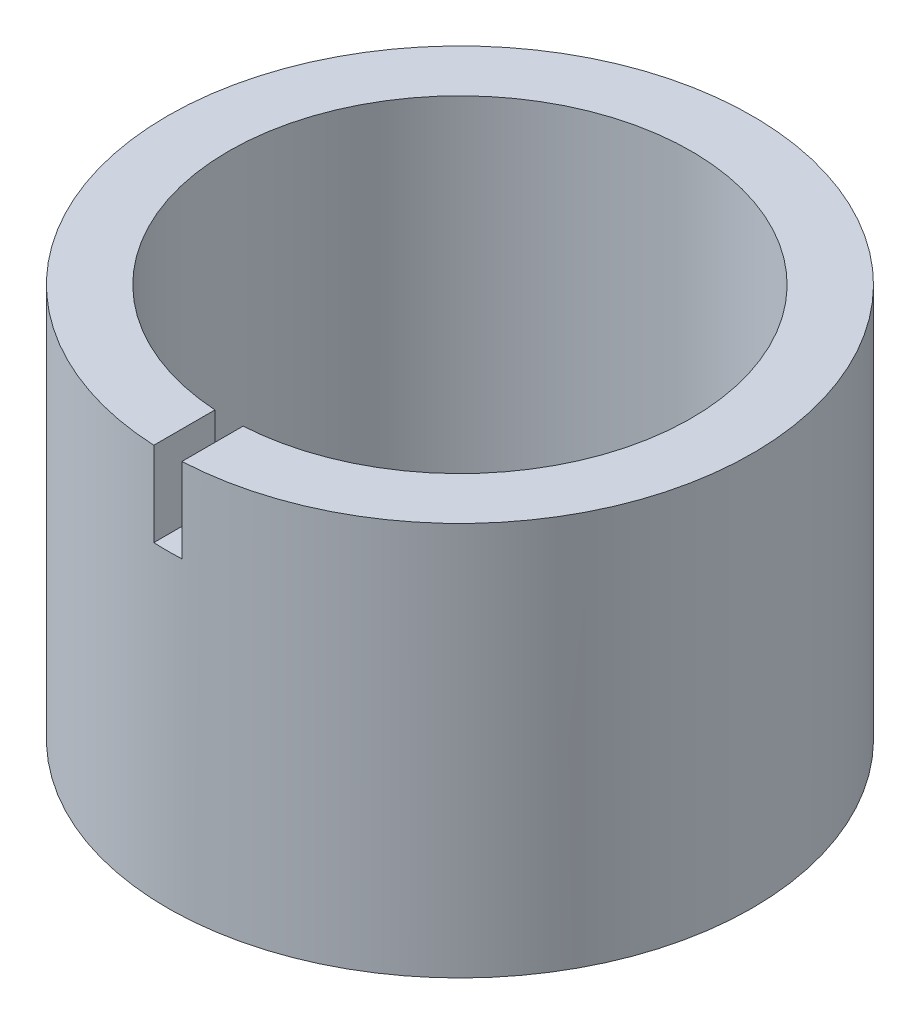
from build123d import *

# Parameters (mm, degrees)
SKETCH1_R           = 13.208
SKETCH1_R_2         = 10.45
BOSS_EXTRUDE1_DEPTH = 17.78
SKETCH2_W           = 1.27
SKETCH2_H           = 3.587114975
CUT_EXTRUDE1_DEPTH  = 3.81
SKETCH3_W           = 1.806448
SKETCH3_H           = 4.299301561
CUT_EXTRUDE2_DEPTH  = 3.81


with BuildPart() as part:
    # Sketch1 → Boss-Extrude1 (new body)
    with BuildSketch(Plane(origin=(0, 0, 0), x_dir=(1, 0, 0), z_dir=(0, 1, 0))):
        with Locations(Location((0, 0, 0), (0, 0, 270))):
            Circle(SKETCH1_R)
        with Locations(Location((0, 0, 0), (0, 0, 270))):
            Circle(SKETCH1_R_2, mode=Mode.SUBTRACT)
    extrude(amount=BOSS_EXTRUDE1_DEPTH)

    # Sketch2 → Cut-Extrude1 (cut)
    with BuildSketch(Plane(origin=(0, 17.78, 0), x_dir=(1, 0, 0), z_dir=(0, 1, 0))):
        with Locations((0, -11.851276013)):
            Rectangle(SKETCH2_W, SKETCH2_H)
    extrude(amount=-CUT_EXTRUDE1_DEPTH, mode=Mode.SUBTRACT)

    # Sketch3 → Cut-Extrude2 (cut)
    with BuildSketch(Plane.XZ):
        with Locations((0.268224, -12.348416978)):
            Rectangle(SKETCH3_W, SKETCH3_H)
    extrude(amount=-CUT_EXTRUDE2_DEPTH, mode=Mode.SUBTRACT)


solid = part.part
